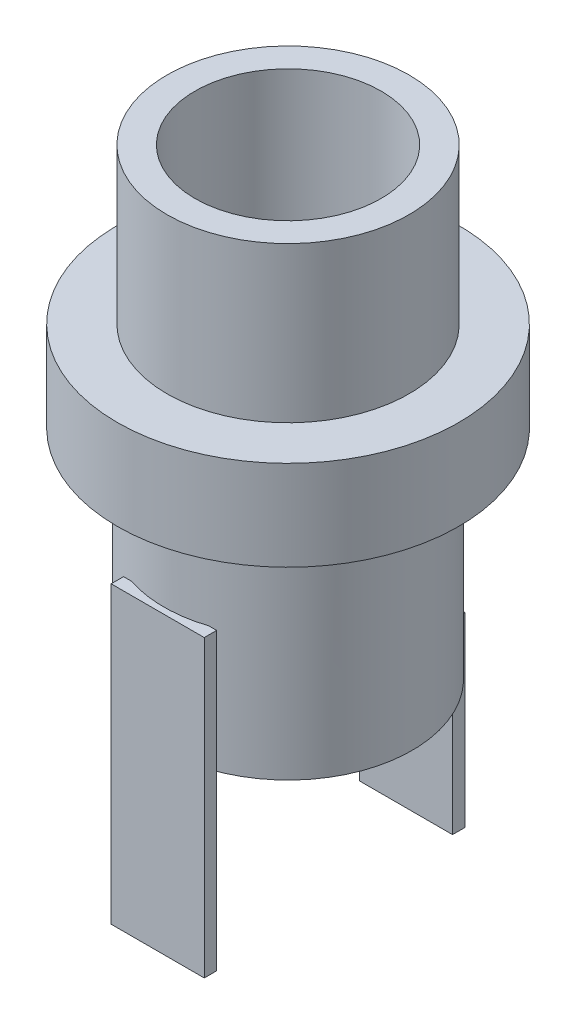
from build123d import *

# Parameters (mm, degrees)
SCHIZZO1_R                   = 5.5
ESTRUSIONE_ESTRUSIONE1_DEPTH = 2.9
SCHIZZO2_R                   = 3.9
ESTRUSIONE_ESTRUSIONE2_DEPTH = 5
SCHIZZO3_R                   = 4
ESTRUSIONE_ESTRUSIONE3_DEPTH = 7
SCHIZZO4_R                   = 3
TAGLIO_ESTRUSIONE1_DEPTH     = 10
SCHIZZO5_W                   = 3
SCHIZZO5_H                   = 9.5
ESTRUSIONE_ESTRUSIONE4_DEPTH = 0.4
SCHIZZO7_W                   = 3
SCHIZZO7_H                   = 6
ESTRUSIONE_ESTRUSIONE5_DEPTH = 0.4
SCHIZZO8_W                   = 3
SCHIZZO8_H                   = 6
ESTRUSIONE_ESTRUSIONE6_DEPTH = 0.4


with BuildPart() as part:
    # Schizzo1 → Estrusione-Estrusione1 (new body)
    with BuildSketch(Plane(origin=(0, 0, 0), x_dir=(1, 0, 0), z_dir=(0, 1, 0))):
        with Locations(Location((0, 0, 0), (0, 0, 270))):
            Circle(SCHIZZO1_R)
    extrude(amount=ESTRUSIONE_ESTRUSIONE1_DEPTH)

    # Schizzo2 → Estrusione-Estrusione2 (add)
    with BuildSketch(Plane(origin=(0, 2.9, 0), x_dir=(1, 0, 0), z_dir=(0, 1, 0))):
        with Locations(Location((0, 0, 0), (0, 0, 270))):
            Circle(SCHIZZO2_R)
    extrude(amount=ESTRUSIONE_ESTRUSIONE2_DEPTH)

    # Schizzo3 → Estrusione-Estrusione3 (add)
    with BuildSketch(Plane.XZ):
        with Locations(Location((0, 0, 0), (0, 0, 270))):
            Circle(SCHIZZO3_R)
    extrude(amount=ESTRUSIONE_ESTRUSIONE3_DEPTH)

    # Schizzo4 → Taglio-Estrusione1 (cut)
    with BuildSketch(Plane(origin=(0, 7.9, 0), x_dir=(1, 0, 0), z_dir=(0, 1, 0))):
        with Locations(Location((0, 0, 0), (0, 0, 270))):
            Circle(SCHIZZO4_R)
    extrude(amount=-TAGLIO_ESTRUSIONE1_DEPTH, mode=Mode.SUBTRACT)

    # Schizzo5 → Estrusione-Estrusione4 (add)
    with BuildSketch(Plane.XY.offset(3.8)):
        with Locations((0, -7.75)):
            Rectangle(SCHIZZO5_W, SCHIZZO5_H)
    extrude(amount=ESTRUSIONE_ESTRUSIONE4_DEPTH)

    # Schizzo7 → Estrusione-Estrusione5 (add)
    with BuildSketch(Plane(origin=(-3.8, 0, 0), x_dir=(0, 0, -1), z_dir=(1, 0, 0))):
        with Locations((0, -9.5)):
            Rectangle(SCHIZZO7_W, SCHIZZO7_H)
    extrude(amount=-ESTRUSIONE_ESTRUSIONE5_DEPTH)

    # Schizzo8 → Estrusione-Estrusione6 (add)
    with BuildSketch(Plane.XY.offset(-3.8)):
        with Locations((0, -9.5)):
            Rectangle(SCHIZZO8_W, SCHIZZO8_H)
    extrude(amount=-ESTRUSIONE_ESTRUSIONE6_DEPTH)


solid = part.part
